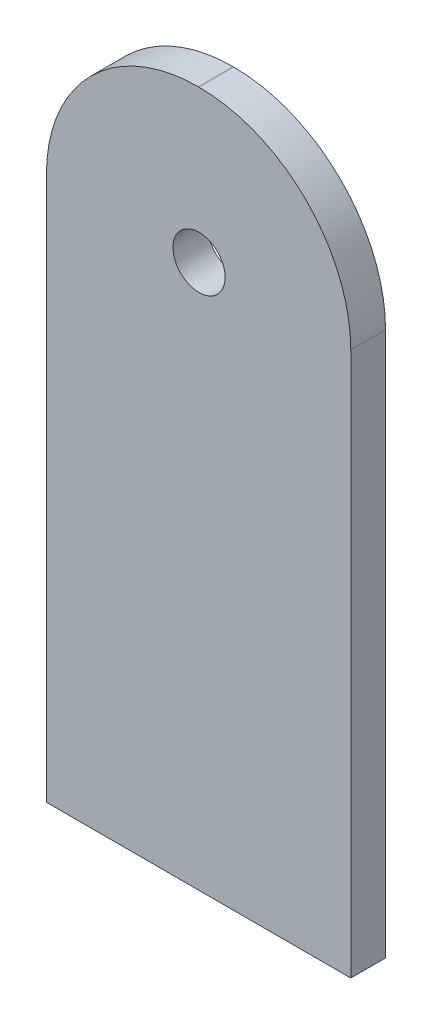
from build123d import *

# Parameters (mm, degrees)
SKETCH_1_R      = 3
EXTRUDE_1_DEPTH = 4


with BuildPart() as part:
    # Эскиз1 → Бобышка-Вытянуть1 (new body)
    with BuildSketch(Plane.XY):
        with BuildLine():
            Line((-17.5, 0), (17.5, 0))
            Line((17.5, 0), (17.5, 62.55))
            ThreePointArc((17.5, 62.55), (12.389013332, 74.889013332), (0.05, 80))
            Line((0.05, 80), (-0.05, 80))
            ThreePointArc((-0.05, 80), (-12.389013332, 74.889013332), (-17.5, 62.55))
            Line((-17.5, 62.55), (-17.5, 0))
        make_face()
        with Locations((0.05, 62.55)):
            Circle(SKETCH_1_R, mode=Mode.SUBTRACT)
    extrude(amount=EXTRUDE_1_DEPTH)


solid = part.part
